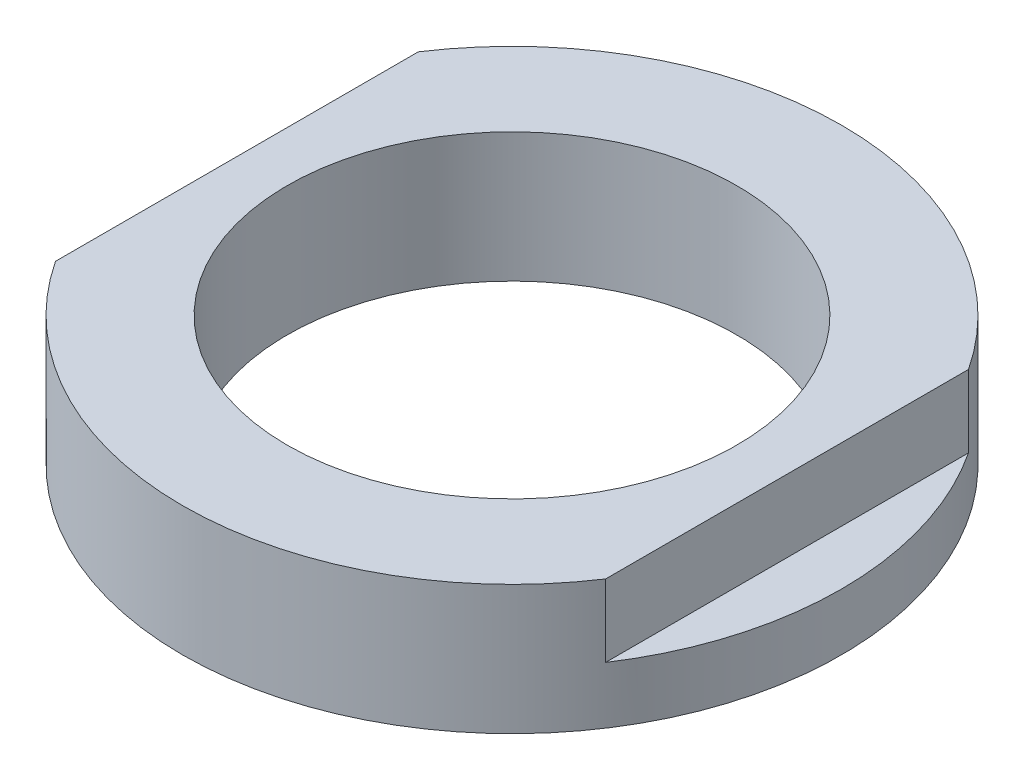
from build123d import *

# Parameters (mm, degrees)
SKETCH1_R           = 14.24
SKETCH1_R_2         = 9.7155
BOSS_EXTRUDE1_DEPTH = 2.794
SKETCH2_W           = 4.55251892
SKETCH2_H           = 21.070507922
CUT_EXTRUDE1_DEPTH  = 3.1242
SKETCH3_R           = 0.75565


with BuildPart() as part:
    # Sketch1 → Boss-Extrude1 (new, symmetric)
    with BuildSketch(Plane(origin=(0, 0, 0), x_dir=(1, 0, 0), z_dir=(0, 1, 0))):
        with Locations(Location((0, 0, 0), (0, 0, 270))):
            Circle(SKETCH1_R)
        with Locations(Location((0, 0, 0), (0, 0, 270))):
            Circle(SKETCH1_R_2, mode=Mode.SUBTRACT)
    extrude(amount=BOSS_EXTRUDE1_DEPTH, both=True)

    # Sketch2 → Cut-Extrude1 (cut)
    with BuildSketch(Plane(origin=(0, 2.794, 0), x_dir=(1, 0, 0), z_dir=(0, 1, 0))):
        with Locations((14.16345946, 0)):
            Rectangle(SKETCH2_W, SKETCH2_H)
    cut_extrude1 = extrude(amount=-CUT_EXTRUDE1_DEPTH, mode=Mode.SUBTRACT)

    # Mirror1: Cut-Extrude1 across plane
    add(cut_extrude1.mirror(Plane(origin=(0, 0, 0), x_dir=(0, 0, 1), z_dir=(1, 0, 0))), mode=Mode.SUBTRACT)

    # Sketch3 → Revolve1 (revolve)
    with BuildSketch(Plane(origin=(0, 0, 0), x_dir=(0, 0, -1), z_dir=(1, 0, 0)), mode=Mode.PRIVATE) as revolve1_sk:
        with Locations((-12.208, -2.794)):
            Circle(SKETCH3_R)
    revolve(revolve1_sk.sketch.rotate(Axis((0, 0, 0), (0, 1, 0)), 236.592446153), axis=Axis((0, 0, 0), (0, 1, 0)))


solid = part.part
